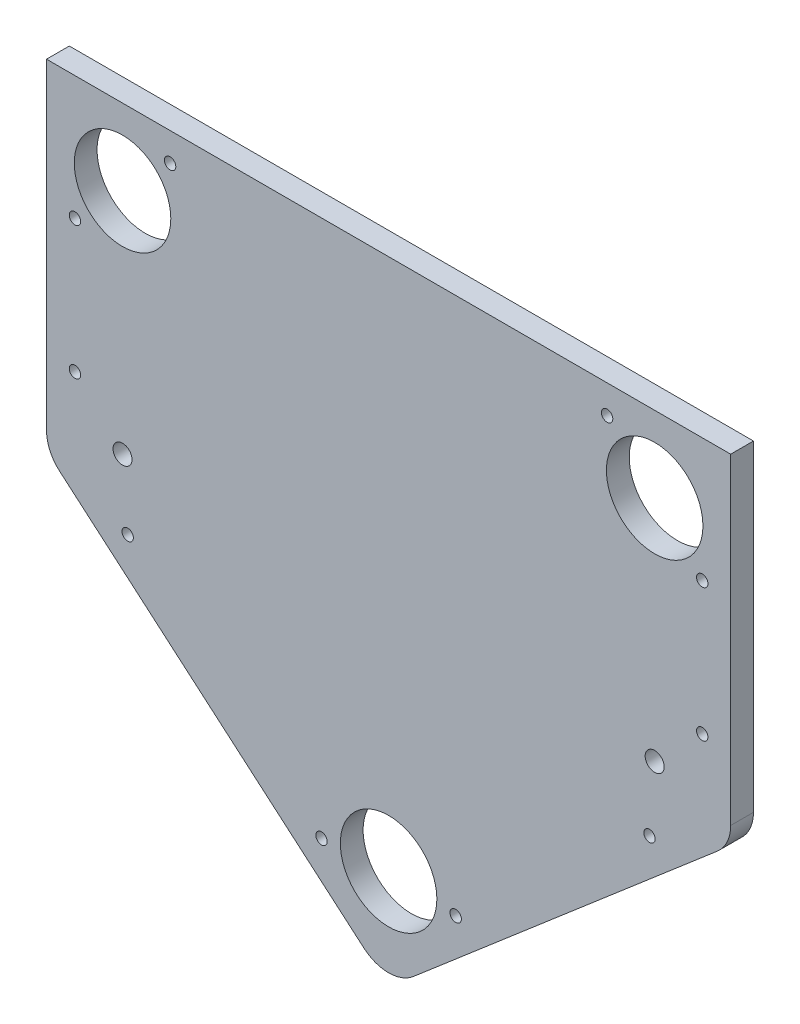
from build123d import *

# Parameters (mm, degrees)
SKETCH1_R           = 12.7
SKETCH1_R_2         = 2.5
SKETCH1_R_3         = 1.5
BOSS_EXTRUDE1_DEPTH = 6
FILLET1_R           = 10


with BuildPart() as part:
    # Sketch1 → Boss-Extrude1 (new body)
    with BuildSketch(Plane.XY):
        Polygon((-90, 80), (90, 80), (90, -9.198698449), (0, -86.341555592), (-90, -9.198698449), align=None)
        with Locations((-70, 60)):
            Circle(SKETCH1_R, mode=Mode.SUBTRACT)
        with Locations((70, 60)):
            Circle(SKETCH1_R, mode=Mode.SUBTRACT)
        with Locations((-70, 0)):
            Circle(SKETCH1_R_2, mode=Mode.SUBTRACT)
        with Locations((70, 0)):
            Circle(SKETCH1_R_2, mode=Mode.SUBTRACT)
        with Locations((0, -60)):
            Circle(SKETCH1_R, mode=Mode.SUBTRACT)
        with Locations((-82.515790027, 47.484209973)):
            Circle(SKETCH1_R_3, mode=Mode.SUBTRACT)
        with Locations((-57.484209973, 72.515790027)):
            Circle(SKETCH1_R_3, mode=Mode.SUBTRACT)
        with Locations((-82.515790027, 12.515790027)):
            Circle(SKETCH1_R_3, mode=Mode.SUBTRACT)
        with Locations((-68.64247197, -17.647864393)):
            Circle(SKETCH1_R_3, mode=Mode.SUBTRACT)
        with Locations((-17.647864393, -61.35752803)):
            Circle(SKETCH1_R_3, mode=Mode.SUBTRACT)
        with Locations(Location((17.647864393, -61.35752803, 0), (0, 0, 180))):
            Circle(SKETCH1_R_3, mode=Mode.SUBTRACT)
        with Locations(Location((68.64247197, -17.647864393, 0), (0, 0, 180))):
            Circle(SKETCH1_R_3, mode=Mode.SUBTRACT)
        with Locations(Location((82.515790027, 12.515790027, 0), (0, 0, 180))):
            Circle(SKETCH1_R_3, mode=Mode.SUBTRACT)
        with Locations(Location((82.515790027, 47.484209973, 0), (0, 0, 180))):
            Circle(SKETCH1_R_3, mode=Mode.SUBTRACT)
        with Locations(Location((57.484209973, 72.515790027, 0), (0, 0, 180))):
            Circle(SKETCH1_R_3, mode=Mode.SUBTRACT)
    extrude(amount=BOSS_EXTRUDE1_DEPTH)

    # Fillet1
    fillet1_edges = [part.edges().sort_by_distance(p)[0] for p in [
        (90, -9.198698449, 3),
        (0, -86.341555592, 3),
        (-90, -9.198698449, 3),
    ]]
    fillet(fillet1_edges, radius=FILLET1_R)


solid = part.part
